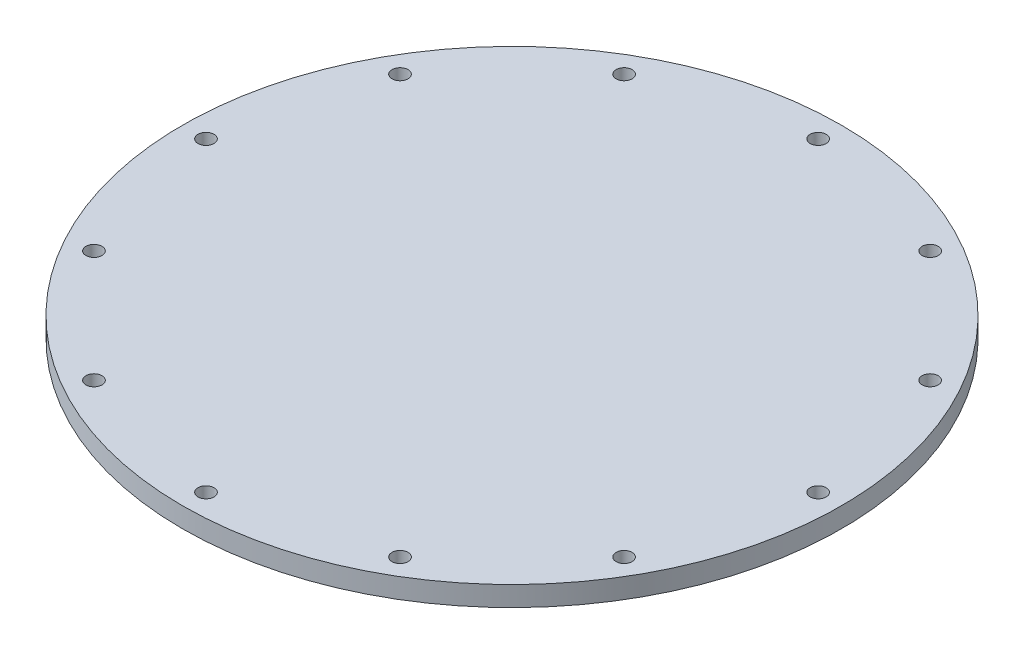
from build123d import *

# Parameters (mm, degrees)
SKETCH2_R          = 104.775
FACE_PLATE_DEPTH   = 6.35
SKETCH3_R          = 2.5527
CUT_EXTRUDE1_DEPTH = 6.35
CIRPATTERN1_COUNT  = 12


with BuildPart() as part:
    # Sketch2 → Face Plate (new body)
    with BuildSketch(Plane(origin=(0, 0, 0), x_dir=(1, 0, 0), z_dir=(0, 1, 0))):
        with Locations(Location((0, 0, 0), (0, 0, 270))):
            Circle(SKETCH2_R)
    extrude(amount=FACE_PLATE_DEPTH)

    # Sketch3 → Cut-Extrude1 (cut)
    with BuildSketch(Plane(origin=(0, 6.35, 0), x_dir=(1, 0, 0), z_dir=(0, 1, 0))):
        with Locations(Location((-84.221187023, 48.625125, 0), (0, 0, 270))):
            Circle(SKETCH3_R)
    cut_extrude1 = extrude(amount=-CUT_EXTRUDE1_DEPTH, mode=Mode.SUBTRACT)

    # CirPattern1: Cut-Extrude1 ×12 about axis
    cirpattern1_axis = Axis((0.050022276, 0, 0.028880374), (0, 1, 0))
    for i in range(1, CIRPATTERN1_COUNT):
        add(cut_extrude1.rotate(cirpattern1_axis, i * 360 / CIRPATTERN1_COUNT), mode=Mode.SUBTRACT)


solid = part.part
